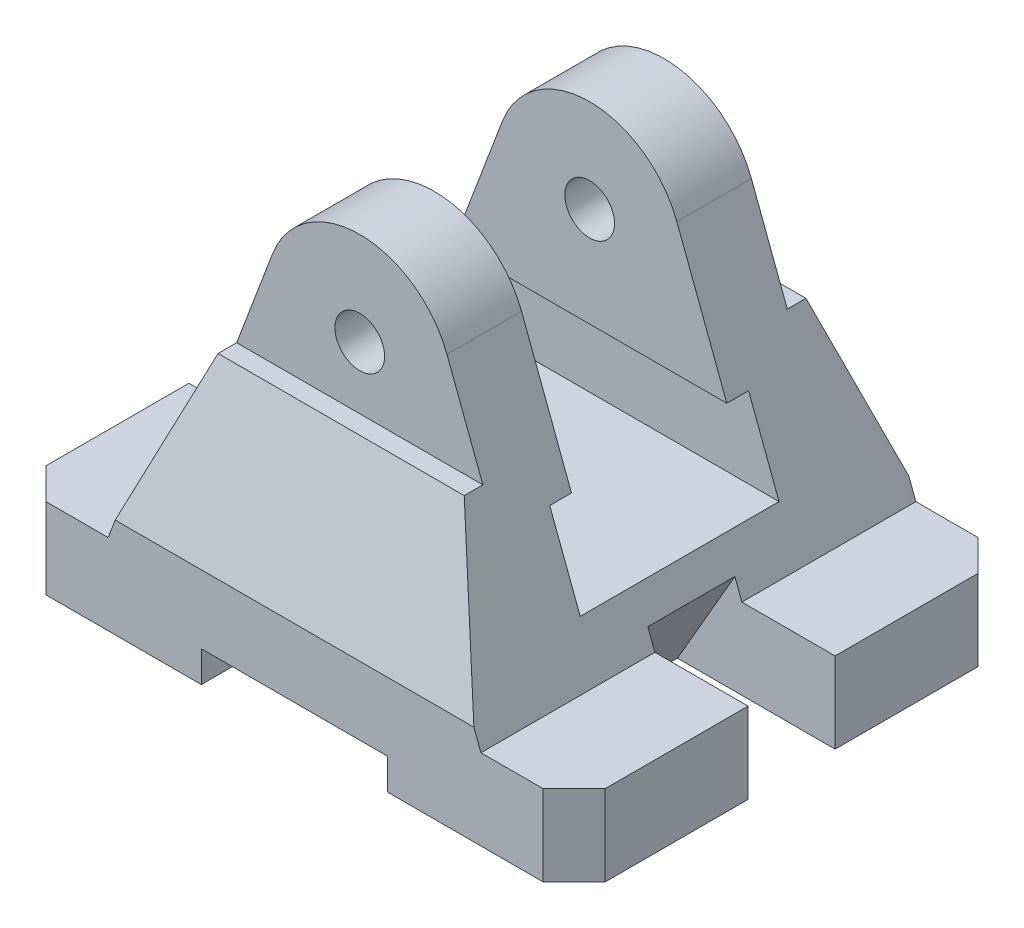
from build123d import *

# Parameters (mm, degrees)
SKETCH1_W                = 70
SKETCH1_H                = 13
BOSS_EXTRUDE1_DEPTH      = 45
CHAMFER1_SIZE            = 5
CUT_EXTRUDE1_DEPTH       = 58.378131723
CUT_EXTRUDE1_DEPTH_BACK  = 58.378131723
SKETCH3_W                = 30
SKETCH3_H                = 5
BOSS_EXTRUDE2_DEPTH      = 35
BOSS_EXTRUDE2_DEPTH_BACK = 35
CUT_EXTRUDE11_DEPTH      = 82.683841731
CUT_EXTRUDE11_DEPTH_BACK = 82.683841731
CUT_EXTRUDE12_DEPTH      = 7
F_8_0_8_DIAMETER_HOLE2_D = 8
M12_TAPPED_HOLE1_D       = 10.2


with BuildPart() as part:
    # Sketch1 → Boss-Extrude1 (new, symmetric)
    with BuildSketch(Plane(origin=(0, 0, 0), x_dir=(0, 0, -1), z_dir=(1, 0, 0))):
        Rectangle(SKETCH1_W, SKETCH1_H)
    extrude(amount=BOSS_EXTRUDE1_DEPTH, both=True)

    # Chamfer1
    chamfer1_edges = [part.edges().sort_by_distance(p)[0] for p in [
        (45, 0, -35),
        (45, 0, 35),
        (-45, 0, -35),
        (-45, 0, 35),
    ]]
    chamfer(chamfer1_edges, length=CHAMFER1_SIZE)

    # Sketch3 → Cut-Extrude1 (cut, two sides: drawn at the far end of the back side and taken through both)
    with BuildSketch(Plane.XY.offset(-CUT_EXTRUDE1_DEPTH_BACK)):
        with Locations((0, -4)):
            Rectangle(SKETCH3_W, SKETCH3_H)
    extrude(amount=CUT_EXTRUDE1_DEPTH + CUT_EXTRUDE1_DEPTH_BACK, mode=Mode.SUBTRACT)

    # Sketch4 → Boss-Extrude2 (add, two sides: drawn at the far end of the back side and taken through both)
    with BuildSketch(Plane.XY.offset(-BOSS_EXTRUDE2_DEPTH_BACK)):
        with BuildLine():
            Line((-30, 6.5), (-14.033447824, 48.797390128))
            ThreePointArc((-14.033447824, 48.797390128), (0, 58.5), (14.033447824, 48.797390128))
            Line((14.033447824, 48.797390128), (30, 6.5))
            Line((30, 6.5), (-30, 6.5))
        make_face()
    extrude(amount=BOSS_EXTRUDE2_DEPTH + BOSS_EXTRUDE2_DEPTH_BACK)

    # Sketch13 → Cut-Extrude11 (cut, two sides: drawn at the far end of the back side and taken through both)
    with BuildSketch(Plane(origin=(0, 0, 0), x_dir=(0, 0, -1), z_dir=(1, 0, 0)).offset(-CUT_EXTRUDE11_DEPTH_BACK)):
        Polygon((-88.955494026, -163.157580884), (-35, 9.5), (-27.5, 33.5), (-24.5, 33.5), (-24.5, 58.5), (-12.5, 58.5), (-12.5, 27.5), (-16, 27.5), (-16, 14.5), (16, 14.5), (16, 27.5), (12.5, 27.5), (12.5, 58.5), (24.5, 58.5), (24.5, 33.5), (27.5, 33.5), (35, 9.5), (88.955494026, -163.157580884), (88.955494026, 198.625976356), (-88.955494026, 198.625976356), align=None)
    extrude(amount=CUT_EXTRUDE11_DEPTH + CUT_EXTRUDE11_DEPTH_BACK, mode=Mode.SUBTRACT)

    # Sketch14 → Cut-Extrude12 (cut, symmetric)
    with BuildSketch(Plane.XY):
        Polygon((28.867550542, 9.5), (19.629946235, -6.5), (45, -6.5), (45, 6.5), (30, 6.5), align=None)
    cut_extrude12 = extrude(amount=CUT_EXTRUDE12_DEPTH, both=True, mode=Mode.SUBTRACT)

    # Mirror1: Cut-Extrude12 across plane
    add(cut_extrude12.mirror(Plane(origin=(0, 0, 0), x_dir=(0, 0, 1), z_dir=(1, 0, 0))), mode=Mode.SUBTRACT)

    # Ø8.0 (8) Diameter Hole2 (through all)
    with Locations(Plane.XY.offset(24.5)):
        with Locations((0, 43.5)):
            Hole(F_8_0_8_DIAMETER_HOLE2_D / 2)

    # M12 Tapped Hole1 (through all)
    with Locations(Plane(origin=(0, 14.5, 0), x_dir=(1, 0, 0), z_dir=(0, 1, 0))):
        with Locations((0, 0)):
            Hole(M12_TAPPED_HOLE1_D / 2)


solid = part.part
